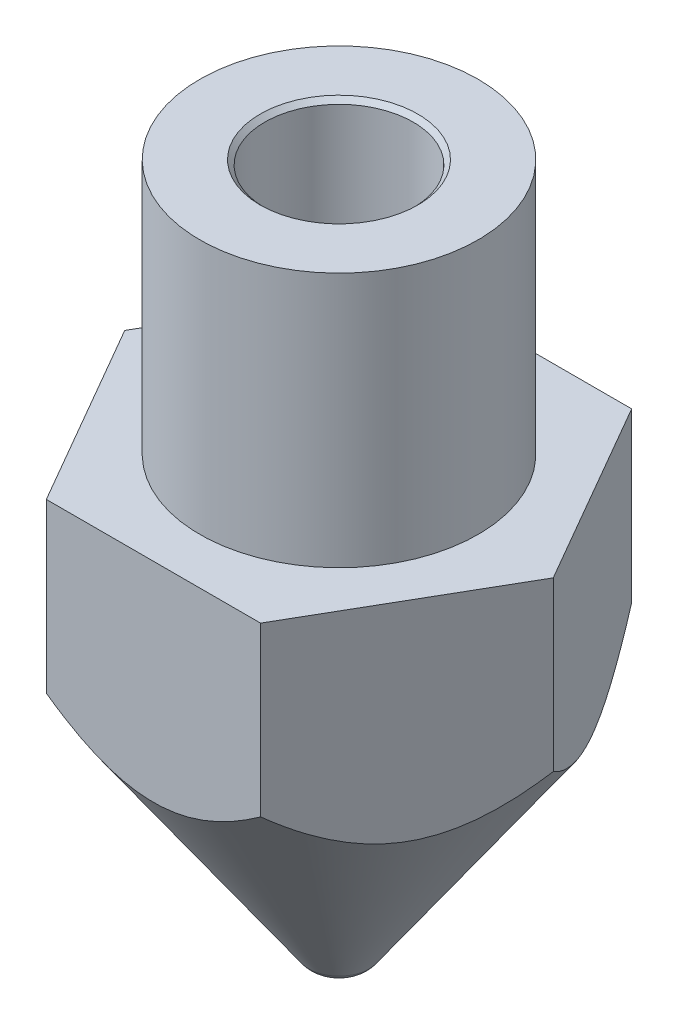
from build123d import *

# Parameters (mm, degrees)
SALIENTE_EXTRUIR1_START = -5
CROQUIS3_R              = 3.650933922
SALIENTE_EXTRUIR1_DEPTH = 5
REDONDEO1_R             = 0.5
CHAFL_N1_SIZE           = 0.1


with BuildPart() as part:
    # Croquis1 → Revolución1 (revolve)
    with BuildSketch(Plane.XY, mode=Mode.PRIVATE) as revoluci_n1_sk:
        Polygon((0.2, 0), (0.2, 1.2), (1.6, 3.199407209), (1.6, 15), (3, 15), (3, 9.5), (3.650933922, 9.5), (3.650933922, 4.5), (0.5, 0), align=None)
    revolve(revoluci_n1_sk.sketch.rotate(Axis((0, 0, 0), (0, 1, 0)), 90), axis=Axis((0, 0, 0), (0, 1, 0)))

    # Croquis3 → Saliente-Extruir1 (add)
    with BuildSketch(Plane(origin=(0, 9.5, 0), x_dir=(1, 0, 0), z_dir=(0, 1, 0)).offset(SALIENTE_EXTRUIR1_START)):
        Polygon((-2.309401077, -4), (2.309401077, -4), (4.618802154, 0), (2.309401077, 4), (-2.309401077, 4), (-4.618802154, 0), align=None)
        Circle(CROQUIS3_R, mode=Mode.SUBTRACT)
    extrude(amount=SALIENTE_EXTRUIR1_DEPTH)

    # Redondeo1
    redondeo1_edges = [part.edges().sort_by_distance(p)[0] for p in [
        (0, 0, 0.5),
    ]]
    fillet(redondeo1_edges, radius=REDONDEO1_R)

    # Chaflán1
    chafl_n1_edges = [part.edges().sort_by_distance(p)[0] for p in [
        (0, 15, 1.6),
    ]]
    chamfer(chafl_n1_edges, length=CHAFL_N1_SIZE)

    # Croquis5 → Cortar-Revolución1 (revolve, cut)
    with BuildSketch(Plane.XY, mode=Mode.PRIVATE) as cortar_revoluci_n1_sk:
        Polygon((3.650933922, 4.5), (4.618802154, 5.882259086), (4.618802154, 4.5), align=None)
    revolve(cortar_revoluci_n1_sk.sketch.rotate(Axis((0, 15, 0), (0, -1, 0)), 90), axis=Axis((0, 15, 0), (0, -1, 0)), mode=Mode.SUBTRACT)


solid = part.part
